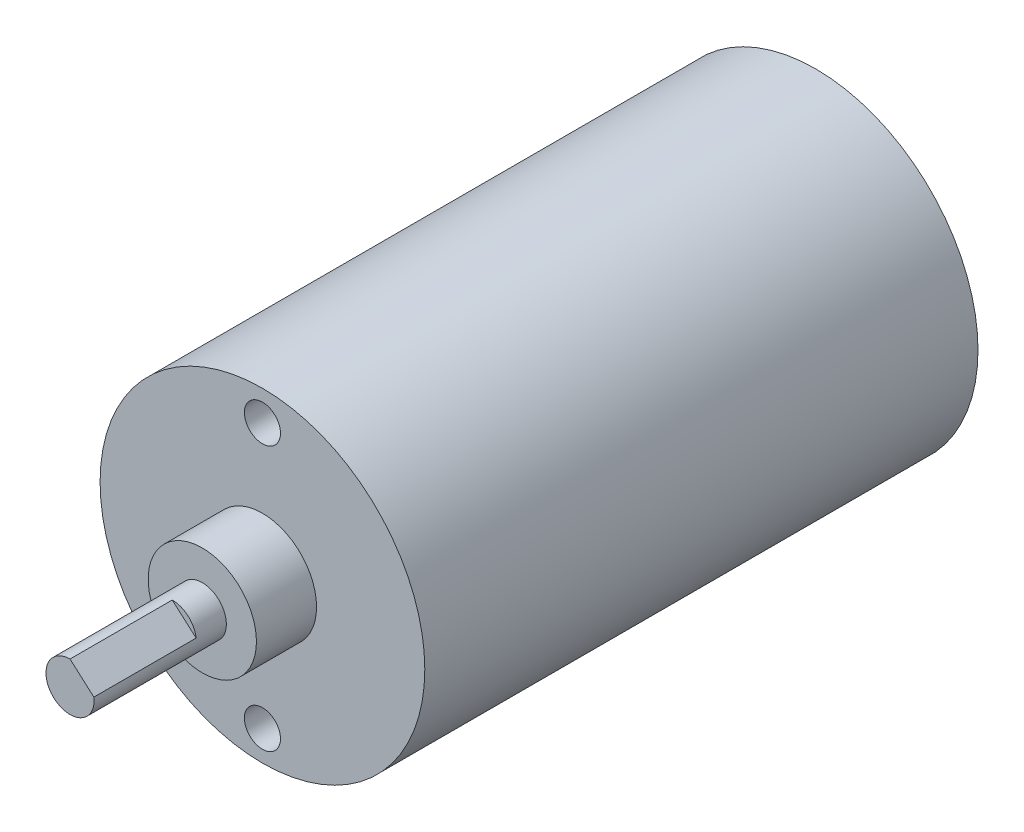
from build123d import *

# Parameters (mm, degrees)
SCHIZZO1_R                   = 13.5
ESTRUSIONE_ESTRUSIONE1_DEPTH = 46
SCHIZZO2_R                   = 4.5
ESTRUSIONE_ESTRUSIONE2_DEPTH = 5
SCHIZZO4_R                   = 2
ESTRUSIONE_ESTRUSIONE3_DEPTH = 2.5
ESTRUSIONE_ESTRUSIONE4_DEPTH = 8.5
SCHIZZO6_R                   = 1.5
TAGLIO_ESTRUSIONE1_DEPTH     = 10


with BuildPart() as part:
    # Schizzo1 → Estrusione-Estrusione1 (new body)
    with BuildSketch(Plane.XY):
        Circle(SCHIZZO1_R)
    extrude(amount=ESTRUSIONE_ESTRUSIONE1_DEPTH)

    # Schizzo2 → Estrusione-Estrusione2 (add)
    with BuildSketch(Plane.XY.offset(46)):
        Circle(SCHIZZO2_R)
    extrude(amount=ESTRUSIONE_ESTRUSIONE2_DEPTH)

    # Schizzo4 → Estrusione-Estrusione3 (add)
    with BuildSketch(Plane.XY.offset(51)):
        Circle(SCHIZZO4_R)
    extrude(amount=ESTRUSIONE_ESTRUSIONE3_DEPTH)

    # Schizzo5 → Estrusione-Estrusione4 (add)
    with BuildSketch(Plane.XY.offset(53.5)):
        with BuildLine():
            Line((1.984313483, 0.25), (0, 2))
            ThreePointArc((0, 2), (-1.414213562, -1.414213562), (2, 0))
            ThreePointArc((2, 0), (1.996074518, 0.125245825), (1.984313483, 0.25))
        make_face()
    extrude(amount=ESTRUSIONE_ESTRUSIONE4_DEPTH)

    # Schizzo6 → Taglio-Estrusione1 (cut)
    with BuildSketch(Plane.XY.offset(46)):
        with Locations((0, 11)):
            Circle(SCHIZZO6_R)
        with Locations((0, -11)):
            Circle(SCHIZZO6_R)
    extrude(amount=-TAGLIO_ESTRUSIONE1_DEPTH, mode=Mode.SUBTRACT)


solid = part.part
